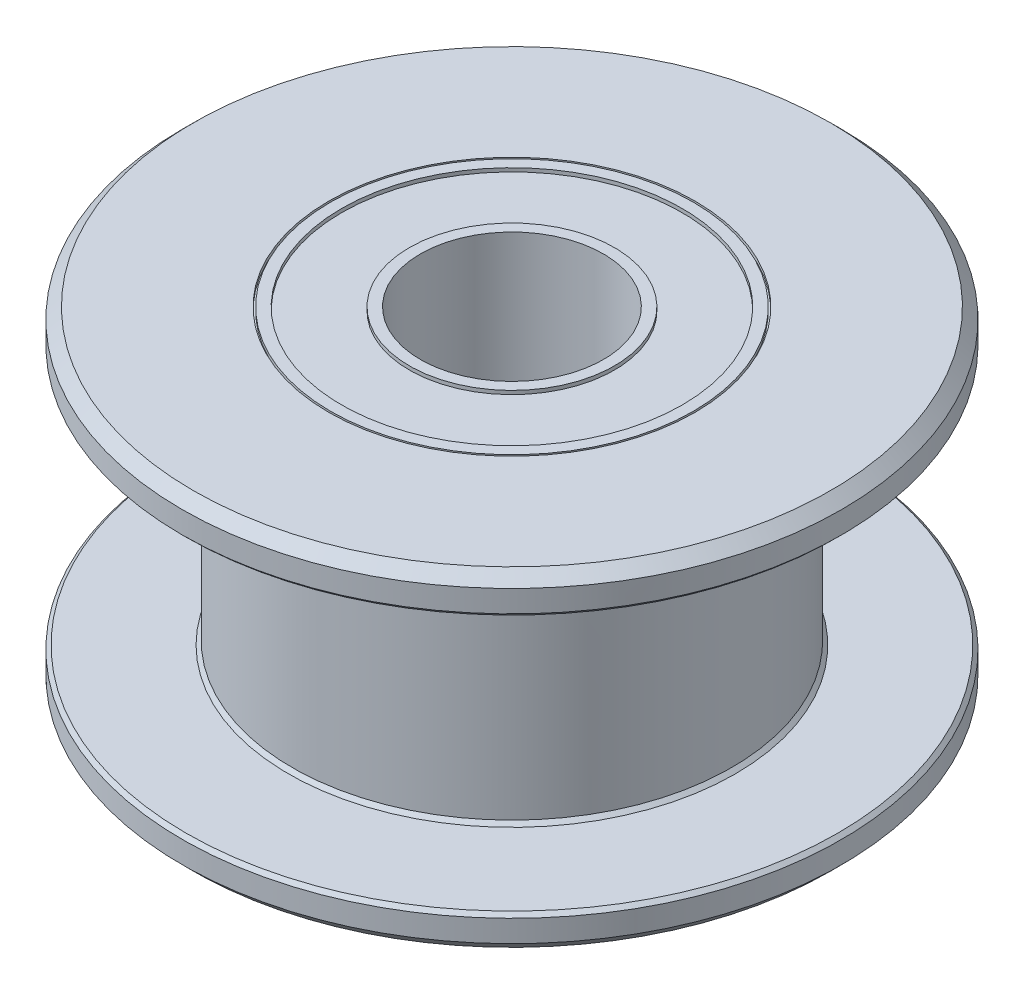
from build123d import *

# Parameters (mm, degrees)
CHAFL_N3_SIZE = 0.3
CHAFL_N4_SIZE = 0.1


with BuildPart() as part:
    # Croquis1 → Revolución3 (revolve)
    with BuildSketch(Plane.XY):
        Polygon((6.5, 4.5), (2.5, 4.5), (2.5, 4.4), (2.45, 4.4), (2.45, 4.5), (2.15, 4.5), (2.15, 4.4), (0.3, 4.4), (0.3, 4.5), (0, 4.5), (0, 0.05), (0, -4.4), (1.7, -4.4), (1.7, -4.5), (6.5, -4.5), (6.5, -3.5), (3.5, -3.5), (3.5, 3.5), (6.5, 3.5), align=None)
    revolve(axis=Axis((-2.5, 4.5, 0), (0, -1, 0)))

    # Chaflán3
    chafl_n3_edges = [part.edges().sort_by_distance(p)[0] for p in [
        (-11.5, -4.5, 0),
        (-11.5, 4.5, 0),
    ]]
    chamfer(chafl_n3_edges, length=CHAFL_N3_SIZE)

    # Chaflán4
    chafl_n4_edges = [part.edges().sort_by_distance(p)[0] for p in [
        (-11.5, -3.5, 0),
        (-8.5, -3.5, 0),
        (-11.5, 3.5, 0),
    ]]
    chamfer(chafl_n4_edges, length=CHAFL_N4_SIZE)


solid = part.part
